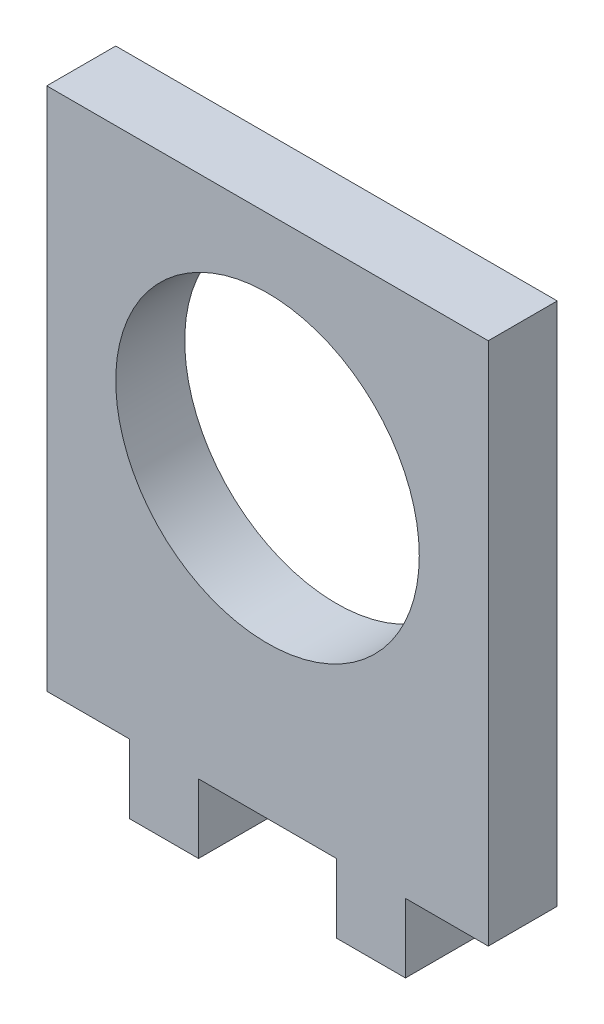
from build123d import *

# Parameters (mm, degrees)
SKETCH1_W           = 5
SKETCH1_H           = 5
SKETCH1_W_2         = 32
SKETCH1_H_2         = 38
SKETCH1_R           = 11
BOSS_EXTRUDE1_DEPTH = 5


with BuildPart() as part:
    # Sketch1 → Boss-Extrude1 (new body)
    # profile 1 of 3: a face of its own
    with BuildSketch(Plane.XY):
        with Locations((7.5, -24.5)):
            Rectangle(SKETCH1_W, SKETCH1_H)
    # profile 2 of 3: a face of its own
    with BuildSketch(Plane.XY):
        with Locations((-7.5, -24.5)):
            Rectangle(SKETCH1_W, SKETCH1_H)
    # profile 3 of 3: a face of its own
    with BuildSketch(Plane.XY):
        with Locations((0, -3)):
            Rectangle(SKETCH1_W_2, SKETCH1_H_2)
        Circle(SKETCH1_R, mode=Mode.SUBTRACT)
    extrude(amount=BOSS_EXTRUDE1_DEPTH)


solid = part.part
